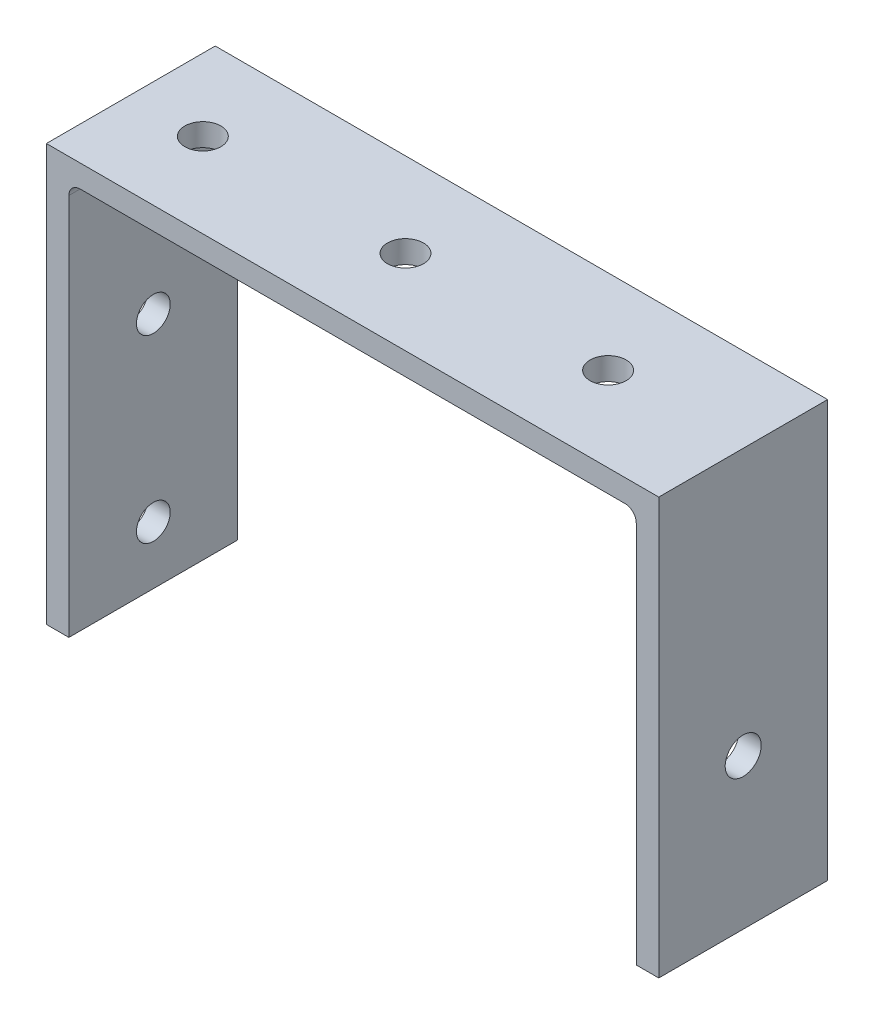
from build123d import *

# Parameters (mm, degrees)
ESQUISSE1_W             = 54.4
ESQUISSE1_H             = 15
BOSS_EXTRU_1_DEPTH      = 2
ESQUISSE2_W             = 2
ESQUISSE2_H             = 15
BOSS_EXTRU_2_DEPTH      = 35
CONG_1_R                = 1
ENL_V_MAT_EXTRU_1_REACH = 68.403
ESQUISSE3_R             = 1.6
ENL_V_MAT_EXTRU_2_REACH = 69.479
ESQUISSE4_R             = 1.6
ENL_V_MAT_EXTRU_3_REACH = 68.403
ESQUISSE6_R             = 1.5


with BuildPart() as part:
    # Esquisse1 → Boss.-Extru.1 (new body)
    with BuildSketch(Plane(origin=(0, 0, 0), x_dir=(1, 0, 0), z_dir=(0, 1, 0))):
        with Locations((27.2, 7.5)):
            Rectangle(ESQUISSE1_W, ESQUISSE1_H)
    extrude(amount=BOSS_EXTRU_1_DEPTH)

    # Esquisse2 → Boss.-Extru.2 (add)
    with BuildSketch(Plane.XZ):
        with Locations((1, -7.5)):
            Rectangle(ESQUISSE2_W, ESQUISSE2_H)
        with Locations((53.4, -7.5)):
            Rectangle(ESQUISSE2_W, ESQUISSE2_H)
    extrude(amount=BOSS_EXTRU_2_DEPTH)

    # Congé1
    cong_1_edges = [part.edges().sort_by_distance(p)[0] for p in [
        (52.4, 0, -7.5),
        (2, 0, -7.5),
    ]]
    fillet(cong_1_edges, radius=CONG_1_R)

    # Esquisse3 → Enlèv. mat.-Extru.1 (cut, up to next)
    with BuildSketch(Plane(origin=(54.4, 0, 0), x_dir=(0, 0, -1), z_dir=(1, 0, 0)), mode=Mode.PRIVATE) as enl_v_mat_extru_1_sk1:
        with Locations((7.5, -21.65)):
            Circle(ESQUISSE3_R)
    enl_v_mat_extru_1_tool1 = extrude(enl_v_mat_extru_1_sk1.sketch, amount=-ENL_V_MAT_EXTRU_1_REACH, mode=Mode.PRIVATE) & part.part
    add(enl_v_mat_extru_1_tool1.solids().sort_by_distance((54.4, -21.65, -7.5))[0], mode=Mode.SUBTRACT)

    # Esquisse4 → Enlèv. mat.-Extru.2 (cut, up to next)
    with BuildSketch(Plane(origin=(0, 2, 0), x_dir=(1, 0, 0), z_dir=(0, 1, 0)), mode=Mode.PRIVATE) as enl_v_mat_extru_2_sk1:
        with Locations(Location((42.4, 7.5, 0), (0, 0, 270))):
            Circle(ESQUISSE4_R)
    enl_v_mat_extru_2_tool1 = extrude(enl_v_mat_extru_2_sk1.sketch, amount=-ENL_V_MAT_EXTRU_2_REACH, mode=Mode.PRIVATE) & part.part
    # Esquisse4 → Enlèv. mat.-Extru.2 (cut, up to next)
    with BuildSketch(Plane(origin=(0, 2, 0), x_dir=(1, 0, 0), z_dir=(0, 1, 0)), mode=Mode.PRIVATE) as enl_v_mat_extru_2_sk2:
        with Locations(Location((6.4, 7.5, 0), (0, 0, 270))):
            Circle(ESQUISSE4_R)
    enl_v_mat_extru_2_tool2 = extrude(enl_v_mat_extru_2_sk2.sketch, amount=-ENL_V_MAT_EXTRU_2_REACH, mode=Mode.PRIVATE) & part.part
    # Esquisse4 → Enlèv. mat.-Extru.2 (cut, up to next)
    with BuildSketch(Plane(origin=(0, 2, 0), x_dir=(1, 0, 0), z_dir=(0, 1, 0)), mode=Mode.PRIVATE) as enl_v_mat_extru_2_sk3:
        with Locations(Location((24.4, 7.5, 0), (0, 0, 270))):
            Circle(ESQUISSE4_R)
    enl_v_mat_extru_2_tool3 = extrude(enl_v_mat_extru_2_sk3.sketch, amount=-ENL_V_MAT_EXTRU_2_REACH, mode=Mode.PRIVATE) & part.part
    add(enl_v_mat_extru_2_tool1.solids().sort_by_distance((42.4, 2, -7.5))[0], mode=Mode.SUBTRACT)
    add(enl_v_mat_extru_2_tool2.solids().sort_by_distance((6.4, 2, -7.5))[0], mode=Mode.SUBTRACT)
    add(enl_v_mat_extru_2_tool3.solids().sort_by_distance((24.4, 2, -7.5))[0], mode=Mode.SUBTRACT)

    # Esquisse6 → Enlèv. mat.-Extru.3 (cut, up to next)
    with BuildSketch(Plane.ZY, mode=Mode.PRIVATE) as enl_v_mat_extru_3_sk1:
        with Locations((-7.5, -13.86)):
            Circle(ESQUISSE6_R)
    enl_v_mat_extru_3_tool1 = extrude(enl_v_mat_extru_3_sk1.sketch, amount=-ENL_V_MAT_EXTRU_3_REACH, mode=Mode.PRIVATE) & part.part
    # Esquisse6 → Enlèv. mat.-Extru.3 (cut, up to next)
    with BuildSketch(Plane.ZY, mode=Mode.PRIVATE) as enl_v_mat_extru_3_sk2:
        with Locations((-7.5, -29.86)):
            Circle(ESQUISSE6_R)
    enl_v_mat_extru_3_tool2 = extrude(enl_v_mat_extru_3_sk2.sketch, amount=-ENL_V_MAT_EXTRU_3_REACH, mode=Mode.PRIVATE) & part.part
    add(enl_v_mat_extru_3_tool1.solids().sort_by_distance((0, -13.86, -7.5))[0], mode=Mode.SUBTRACT)
    add(enl_v_mat_extru_3_tool2.solids().sort_by_distance((0, -29.86, -7.5))[0], mode=Mode.SUBTRACT)


solid = part.part
